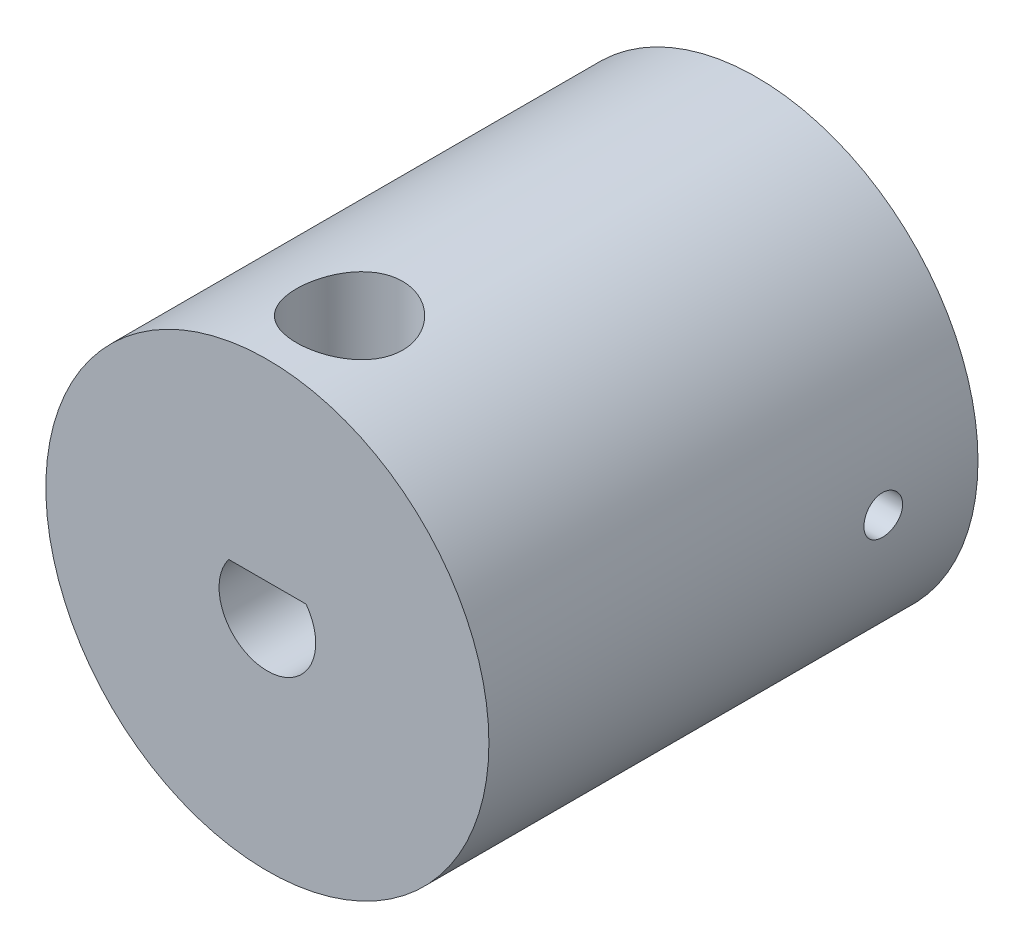
from build123d import *
from build123d.topology import SkipClean

# Parameters (mm, degrees)
BOSS_EXTRUDE1_DEPTH = 9.8
SKETCH2_R           = 9.925
BOSS_EXTRUDE2_DEPTH = 7
SKETCH3_W           = 13.5
SKETCH3_H           = 13.5
CUT_EXTRUDE1_DEPTH  = 5
SKETCH4_R           = 5
BOSS_EXTRUDE3_DEPTH = 8.5
SKETCH5_R           = 1
CUT_EXTRUDE2_DEPTH  = 10.5
SKETCH7_W           = 3.5
SKETCH7_H           = 8.12
CUT_EXTRUDE4_DEPTH  = 10.5
SKETCH9_R           = 9.925
SKETCH9_R_2         = 5
BOSS_EXTRUDE4_DEPTH = 8.5
SKETCH14_R          = 11.46
SKETCH14_R_2        = 9.925
BOSS_EXTRUDE5_DEPTH = 15.5
SKETCH6_R           = 2.75
CUT_EXTRUDE3_DEPTH  = 13.5
CUT_EXTRUDE5_DEPTH  = 21


with BuildPart() as part:
    # Sketch1 → Boss-Extrude1 (new body)
    # profile 1 of 5: a face of its own
    with BuildSketch(Plane.XY):
        with BuildLine():
            Line((17.06, 4.06), (10.716715915, 4.06))
            ThreePointArc((10.716715915, 4.06), (-11.46, 0), (10.716715915, -4.06))
            Line((10.716715915, -4.06), (17.06, -4.06))
            Line((17.06, -4.06), (17.06, 4.06))
        make_face()
        with BuildLine():
            Line((-5.14952425, -6.75), (-6.75, -6.75))
            Line((-6.75, -6.75), (-6.75, -5.14952425))
            ThreePointArc((-6.75, -5.14952425), (-8.49, 0), (-6.75, 5.14952425))
            Line((-6.75, 5.14952425), (-6.75, 6.75))
            Line((-6.75, 6.75), (-5.14952425, 6.75))
            ThreePointArc((-5.14952425, 6.75), (0, 8.49), (5.14952425, 6.75))
            Line((5.14952425, 6.75), (6.75, 6.75))
            Line((6.75, 6.75), (6.75, 5.14952425))
            ThreePointArc((6.75, 5.14952425), (8.49, 0), (6.75, -5.14952425))
            Line((6.75, -5.14952425), (6.75, -6.75))
            Line((6.75, -6.75), (5.14952425, -6.75))
            ThreePointArc((5.14952425, -6.75), (0, -8.49), (-5.14952425, -6.75))
        make_face(mode=Mode.SUBTRACT)
    # profile 2 of 5: a face of its own
    with BuildSketch(Plane.XY):
        with BuildLine():
            ThreePointArc((5.14952425, 6.75), (0, 8.49), (-5.14952425, 6.75))
            Line((-5.14952425, 6.75), (5.14952425, 6.75))
        make_face()
    # profile 3 of 5: a face of its own
    with BuildSketch(Plane.XY):
        with BuildLine():
            ThreePointArc((-6.75, 5.14952425), (-8.49, 0), (-6.75, -5.14952425))
            Line((-6.75, -5.14952425), (-6.75, 5.14952425))
        make_face()
    # profile 4 of 5: a face of its own
    with BuildSketch(Plane.XY):
        with BuildLine():
            Line((6.75, 5.14952425), (6.75, -5.14952425))
            ThreePointArc((6.75, -5.14952425), (8.49, 0), (6.75, 5.14952425))
        make_face()
    # profile 5 of 5: a face of its own
    with BuildSketch(Plane.XY):
        with BuildLine():
            Line((5.14952425, -6.75), (-5.14952425, -6.75))
            ThreePointArc((-5.14952425, -6.75), (0, -8.49), (5.14952425, -6.75))
        make_face()
    extrude(amount=BOSS_EXTRUDE1_DEPTH)

    # Sketch2 → Boss-Extrude2 (add)
    with BuildSketch(Plane.XY.offset(9.8)):
        Circle(SKETCH2_R)
    extrude(amount=BOSS_EXTRUDE2_DEPTH)

    # Sketch3 → Cut-Extrude1 (cut)
    with BuildSketch(Plane(origin=(0, 0, 9.8), x_dir=(-1, 0, 0), z_dir=(0, 0, -1))):
        Rectangle(SKETCH3_W, SKETCH3_H)
    extrude(amount=-CUT_EXTRUDE1_DEPTH, mode=Mode.SUBTRACT)

    # Sketch4 → Boss-Extrude3 (add)
    with BuildSketch(Plane.XY.offset(16.8)):
        Circle(SKETCH4_R)
        with BuildLine():
            Line((2, 1.5), (-2, 1.5))
            ThreePointArc((-2, 1.5), (0, -2.5), (2, 1.5))
        make_face(mode=Mode.SUBTRACT)
    extrude(amount=BOSS_EXTRUDE3_DEPTH)

    # Sketch5 → Cut-Extrude2 (cut)
    with BuildSketch(Plane(origin=(17.06, 0, 0), x_dir=(0, 0, -1), z_dir=(1, 0, 0))):
        with Locations(Location((-4.9, 0, 0), (0, 0, 90))):
            Circle(SKETCH5_R)
    extrude(amount=-CUT_EXTRUDE2_DEPTH, mode=Mode.SUBTRACT)

    # Sketch7 → Cut-Extrude4 (cut)
    with BuildSketch(Plane(origin=(0, 0, 0), x_dir=(-1, 0, 0), z_dir=(0, 0, -1))):
        with Locations((-15.31, 0)):
            Rectangle(SKETCH7_W, SKETCH7_H)
    extrude(amount=-CUT_EXTRUDE4_DEPTH, mode=Mode.SUBTRACT)

    # Sketch9 → Boss-Extrude4 (add)
    with BuildSketch(Plane.XY.offset(16.8)):
        Circle(SKETCH9_R)
        Circle(SKETCH9_R_2, mode=Mode.SUBTRACT)
    extrude(amount=BOSS_EXTRUDE4_DEPTH)

    # Sketch14 → Boss-Extrude5 (add)
    with BuildSketch(Plane.XY.offset(9.8)):
        with Locations(Location((0, 0, 0), (0, 0, 339.250937201))):
            Circle(SKETCH14_R)
        Circle(SKETCH14_R_2, mode=Mode.SUBTRACT)
    extrude(amount=BOSS_EXTRUDE5_DEPTH)

    # Sketch6 → Cut-Extrude3 (cut)
    with BuildSketch(Plane.XZ.offset(-1.5)):
        with Locations(Location((0, 21.05, 0), (0, 0, 270))):
            Circle(SKETCH6_R)
    extrude(amount=-CUT_EXTRUDE3_DEPTH, mode=Mode.SUBTRACT)

    # Sketch15 → Cut-Extrude5 (cut)
    with SkipClean():  # the faces are left unmerged after this step: merging them gives an invalid solid
        with BuildSketch(Plane(origin=(0, 0, 0), x_dir=(-1, 0, 0), z_dir=(0, 0, -1))):
            with BuildLine():
                ThreePointArc((-10.716715915, -4.06), (-11.46, 0), (-10.716715915, 4.06))
                Line((-10.716715915, 4.06), (-13.56, 4.06))
                Line((-13.56, 4.06), (-13.56, -4.06))
                Line((-13.56, -4.06), (-10.716715915, -4.06))
            make_face()
        extrude(amount=-CUT_EXTRUDE5_DEPTH, mode=Mode.SUBTRACT)


solid = part.part
